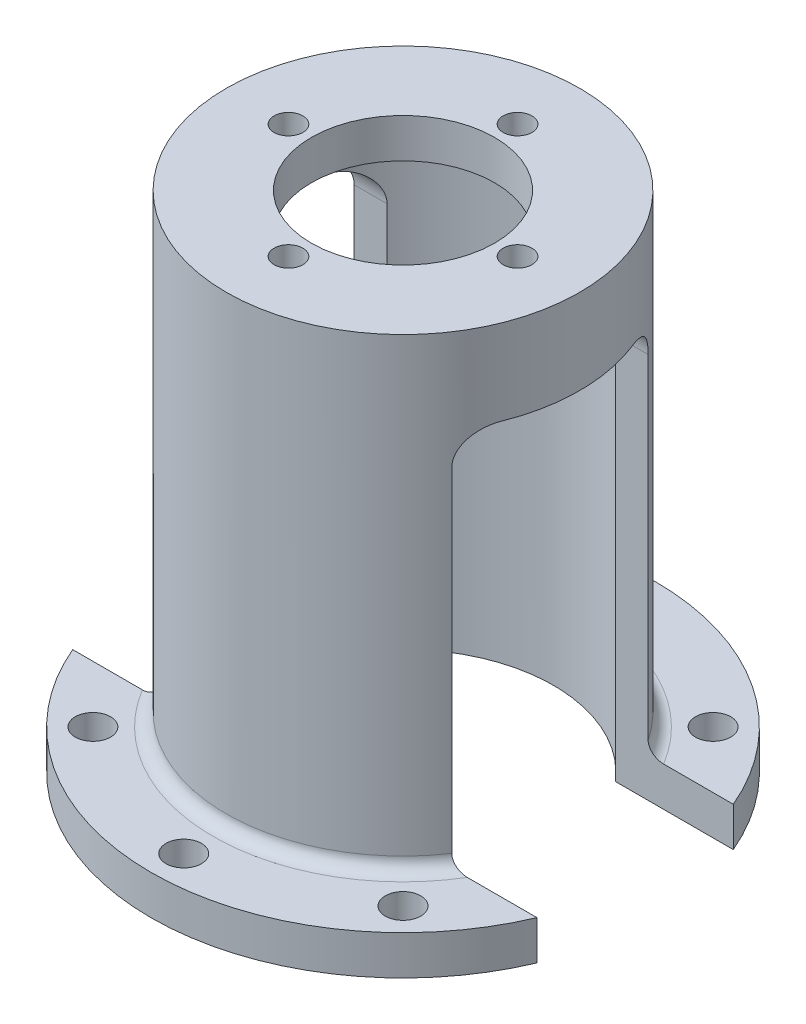
from build123d import *

# Parameters (mm, degrees)
SKETCH1_R               = 27
SKETCH1_R_2             = 23
BOSS_EXTRUDE1_DEPTH     = 77
BOSS_EXTRUDE2_START     = -6
SKETCH2_R               = 27
BOSS_EXTRUDE2_DEPTH     = 6
SKETCH3_R               = 38.5
SKETCH3_R_2             = 23
BOSS_EXTRUDE3_DEPTH     = 6
SKETCH4_R               = 14
CUT_EXTRUDE1_DEPTH      = 95.305355097
CUT_EXTRUDE2_DEPTH      = 95.305355097
CUT_EXTRUDE2_DEPTH_BACK = 95.305355097
FILLET1_R               = 2
SKETCH7_R               = 2.7
CUT_EXTRUDE3_DEPTH      = 89.207142689
CIRPATTERN1_COUNT       = 8
SKETCH8_R               = 2.2
CUT_EXTRUDE4_DEPTH      = 94.104779805
CIRPATTERN2_COUNT       = 4


with BuildPart() as part:
    # Sketch1 → Boss-Extrude1 (new body)
    with BuildSketch(Plane(origin=(0, 0, 0), x_dir=(1, 0, 0), z_dir=(0, 1, 0))):
        Circle(SKETCH1_R)
        Circle(SKETCH1_R_2, mode=Mode.SUBTRACT)
    extrude(amount=BOSS_EXTRUDE1_DEPTH)

    # Sketch2 → Boss-Extrude2 (add)
    with BuildSketch(Plane(origin=(0, 77, 0), x_dir=(1, 0, 0), z_dir=(0, 1, 0)).offset(BOSS_EXTRUDE2_START)):
        Circle(SKETCH2_R)
    extrude(amount=BOSS_EXTRUDE2_DEPTH)

    # Sketch3 → Boss-Extrude3 (add)
    with BuildSketch(Plane.XZ):
        Circle(SKETCH3_R)
        Circle(SKETCH3_R_2, mode=Mode.SUBTRACT)
    extrude(amount=-BOSS_EXTRUDE3_DEPTH)

    # Sketch4 → Cut-Extrude1 (cut, through all)
    with BuildSketch(Plane(origin=(0, 77, 0), x_dir=(1, 0, 0), z_dir=(0, 1, 0))):
        Circle(SKETCH4_R)
    extrude(amount=-CUT_EXTRUDE1_DEPTH, mode=Mode.SUBTRACT)

    # Sketch5 → Cut-Extrude2 (cut, two sides: drawn at the far end of the back side and taken through both)
    with BuildSketch(Plane(origin=(0, 0, 0), x_dir=(0, 0, -1), z_dir=(1, 0, 0)).offset(-CUT_EXTRUDE2_DEPTH_BACK)):
        with BuildLine():
            Line((-15, 0), (-15, 59))
            ThreePointArc((-15, 59), (-13.535533906, 62.535533906), (-10, 64))
            Line((-10, 64), (10, 64))
            ThreePointArc((10, 64), (13.535533906, 62.535533906), (15, 59))
            Line((15, 59), (15, 0))
            Line((15, 0), (-15, 0))
        make_face()
    extrude(amount=CUT_EXTRUDE2_DEPTH + CUT_EXTRUDE2_DEPTH_BACK, mode=Mode.SUBTRACT)

    # Fillet1
    fillet1_edges = [part.edges().sort_by_distance(p)[0] for p in [
        (-23, 71, 0),
        (0, 6, -27),
        (0, 6, 27),
    ]]
    fillet(fillet1_edges, radius=FILLET1_R)

    # Sketch7 → Cut-Extrude3 (cut, through all)
    with BuildSketch(Plane(origin=(0, 6, 0), x_dir=(1, 0, 0), z_dir=(0, 1, 0))):
        with Locations((0, 33.5)):
            Circle(SKETCH7_R)
    cut_extrude3 = extrude(amount=-CUT_EXTRUDE3_DEPTH, mode=Mode.SUBTRACT)

    # CirPattern1: Cut-Extrude3 ×8 about axis, 2 skipped
    cirpattern1_axis = Axis((0, -3.85, 0), (0, 1, 0))
    add([cut_extrude3.rotate(cirpattern1_axis, i * 360 / CIRPATTERN1_COUNT) for i in range(1, CIRPATTERN1_COUNT) if i not in (2, 6)], mode=Mode.SUBTRACT)

    # Sketch8 → Cut-Extrude4 (cut, through all)
    with BuildSketch(Plane(origin=(0, 77, 0), x_dir=(1, 0, 0), z_dir=(0, 1, 0))):
        with Locations((0, 17.5)):
            Circle(SKETCH8_R)
    cut_extrude4 = extrude(amount=-CUT_EXTRUDE4_DEPTH, mode=Mode.SUBTRACT)

    # CirPattern2: Cut-Extrude4 ×4 about axis
    cirpattern2_axis = Axis((0, -3.85, 0), (0, 1, 0))
    for i in range(1, CIRPATTERN2_COUNT):
        add(cut_extrude4.rotate(cirpattern2_axis, i * 360 / CIRPATTERN2_COUNT), mode=Mode.SUBTRACT)


solid = part.part
